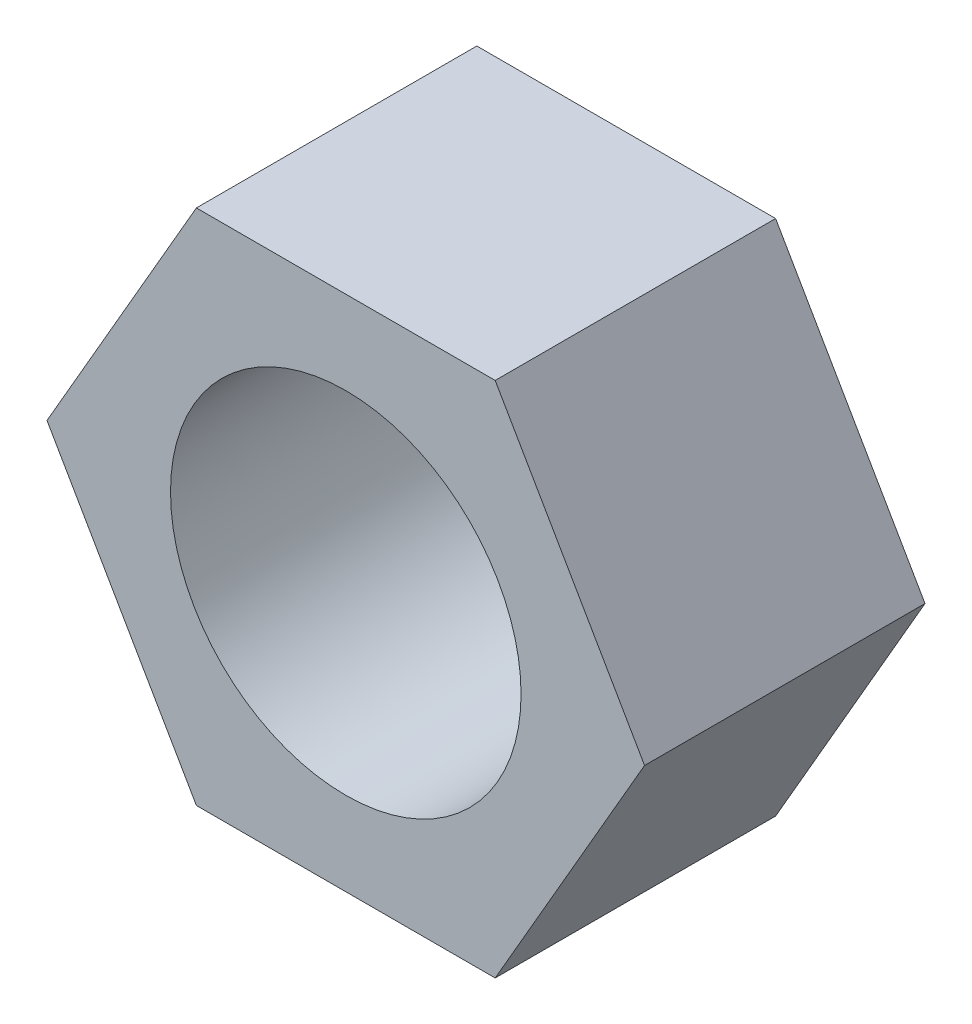
from build123d import *

# Parameters (mm, degrees)
SKETCH1_R           = 2.5
BOSS_EXTRUDE1_DEPTH = 4


with BuildPart() as part:
    # Sketch1 → Boss-Extrude1 (new body)
    with BuildSketch(Plane.XY):
        Polygon((-73.519890998, 77.781745931), (-75.650818464, 81.472620569), (-79.912673397, 81.472620569), (-82.043600863, 77.781745931), (-79.912673397, 74.090871292), (-75.650818464, 74.090871292), align=None)
        with Locations((-77.781745931, 77.781745931)):
            Circle(SKETCH1_R, mode=Mode.SUBTRACT)
    extrude(amount=BOSS_EXTRUDE1_DEPTH)


solid = part.part
